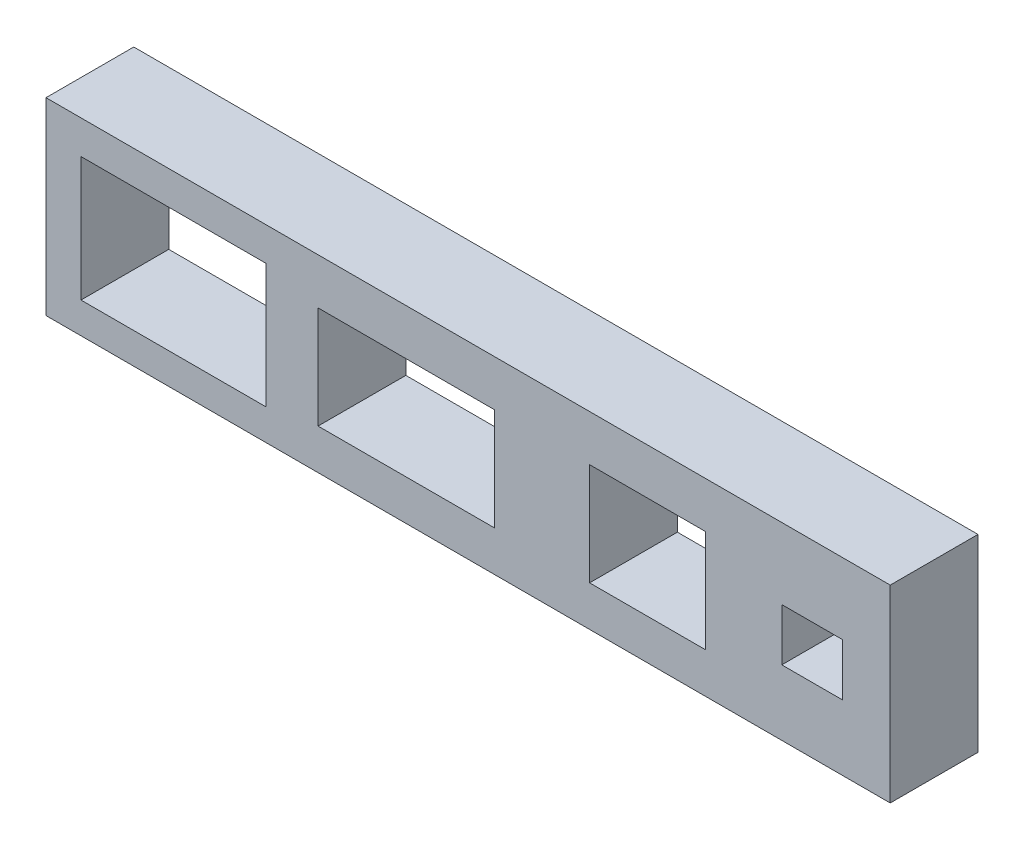
from build123d import *

# Parameters (mm, degrees)
SKETCH1_W           = 96.17484985
SKETCH1_H           = 21.500375375
SKETCH1_W_2         = 21.059516556
SKETCH1_H_2         = 14.158658024
SKETCH1_W_3         = 20.107674
SKETCH1_H_3         = 11.660071314
SKETCH1_W_4         = 13.206815468
SKETCH1_W_5         = 6.900858533
SKETCH1_H_4         = 5.949015977
BOSS_EXTRUDE1_DEPTH = 10


with BuildPart() as part:
    # Sketch1 → Boss-Extrude1 (new body)
    with BuildSketch(Plane.XY):
        with Locations((48.087424925, 10.750187688)):
            Rectangle(SKETCH1_W, SKETCH1_H)
        with Locations((14.515646166, 10.60675503)):
            Rectangle(SKETCH1_W_2, SKETCH1_H_2, mode=Mode.SUBTRACT)
        with Locations((41.048257421, 10.428284551)):
            Rectangle(SKETCH1_W_3, SKETCH1_H_3, mode=Mode.SUBTRACT)
        with Locations((68.532711233, 10.428284551)):
            Rectangle(SKETCH1_W_4, SKETCH1_H_3, mode=Mode.SUBTRACT)
        with Locations((87.272111559, 10.428284551)):
            Rectangle(SKETCH1_W_5, SKETCH1_H_4, mode=Mode.SUBTRACT)
    extrude(amount=BOSS_EXTRUDE1_DEPTH)


solid = part.part
